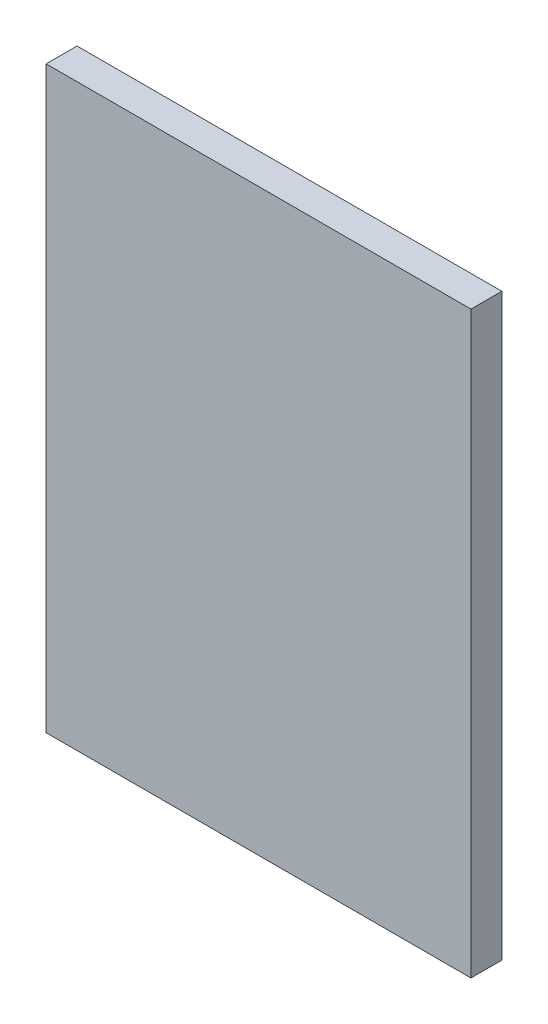
from build123d import *

# Parameters (mm, degrees)
SKETCH_1_W      = 110
SKETCH_1_H      = 150
EXTRUDE_1_DEPTH = 8


with BuildPart() as part:
    # 草图1 → 凸台-拉伸1 (new body)
    with BuildSketch(Plane.XY):
        with Locations((55, 75)):
            Rectangle(SKETCH_1_W, SKETCH_1_H)
    extrude(amount=EXTRUDE_1_DEPTH)


solid = part.part
